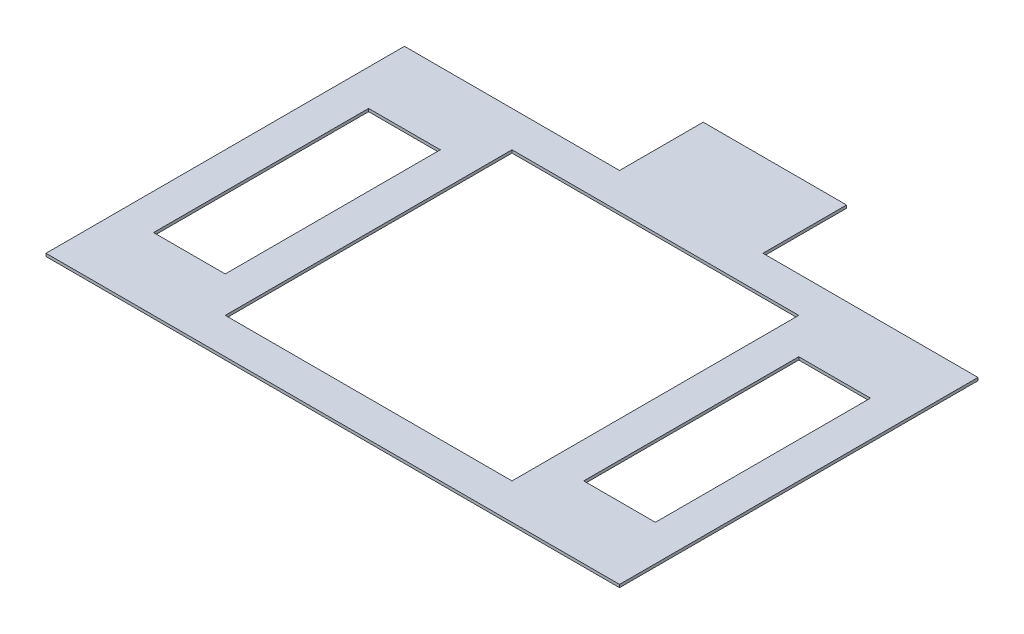
from build123d import *

# Parameters (mm, degrees)
SKETCH1_W           = 300
SKETCH1_H           = 300
SKETCH1_W_2         = 75
SKETCH1_H_2         = 225
BOSS_EXTRUDE1_DEPTH = 3


with BuildPart() as part:
    # Sketch1 → Boss-Extrude1 (new body)
    with BuildSketch(Plane(origin=(0, 0, 0), x_dir=(1, 0, 0), z_dir=(0, 1, 0))):
        Polygon((0, 0), (0, 375), (225, 375), (225, 462.5), (375, 462.5), (375, 375), (600, 375), (600, 0), align=None)
        with Locations((300, 187.5)):
            Rectangle(SKETCH1_W, SKETCH1_H, mode=Mode.SUBTRACT)
        with Locations((75, 187.5)):
            Rectangle(SKETCH1_W_2, SKETCH1_H_2, mode=Mode.SUBTRACT)
        with Locations((525, 187.5)):
            Rectangle(SKETCH1_W_2, SKETCH1_H_2, mode=Mode.SUBTRACT)
    extrude(amount=BOSS_EXTRUDE1_DEPTH)


solid = part.part
